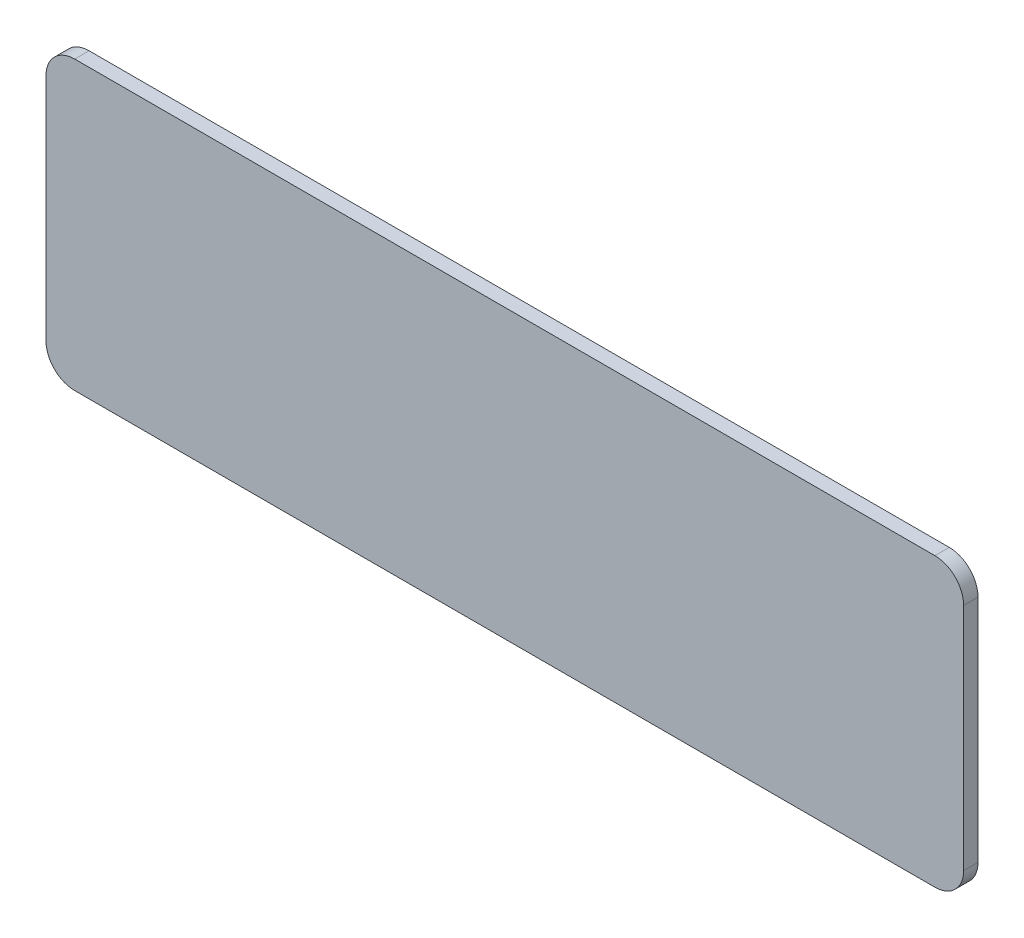
from build123d import *

# Parameters (mm, degrees)
BOSS_EXTRUDE1_DEPTH = 10


with BuildPart() as part:
    # Sketch1 → Boss-Extrude1 (new body)
    with BuildSketch(Plane.XY):
        with BuildLine():
            Line((419.14, 100), (-180, 100))
            ThreePointArc((-180, 100), (-194.142135624, 94.142135624), (-200, 80))
            Line((-200, 80), (-200, -80))
            ThreePointArc((-200, -80), (-194.142135624, -94.142135624), (-180, -100))
            Line((-180, -100), (419.14, -100))
            ThreePointArc((419.14, -100), (433.282135624, -94.142135624), (439.14, -80))
            Line((439.14, -80), (439.14, 80))
            ThreePointArc((439.14, 80), (433.282135624, 94.142135624), (419.14, 100))
        make_face()
    extrude(amount=BOSS_EXTRUDE1_DEPTH)


solid = part.part
